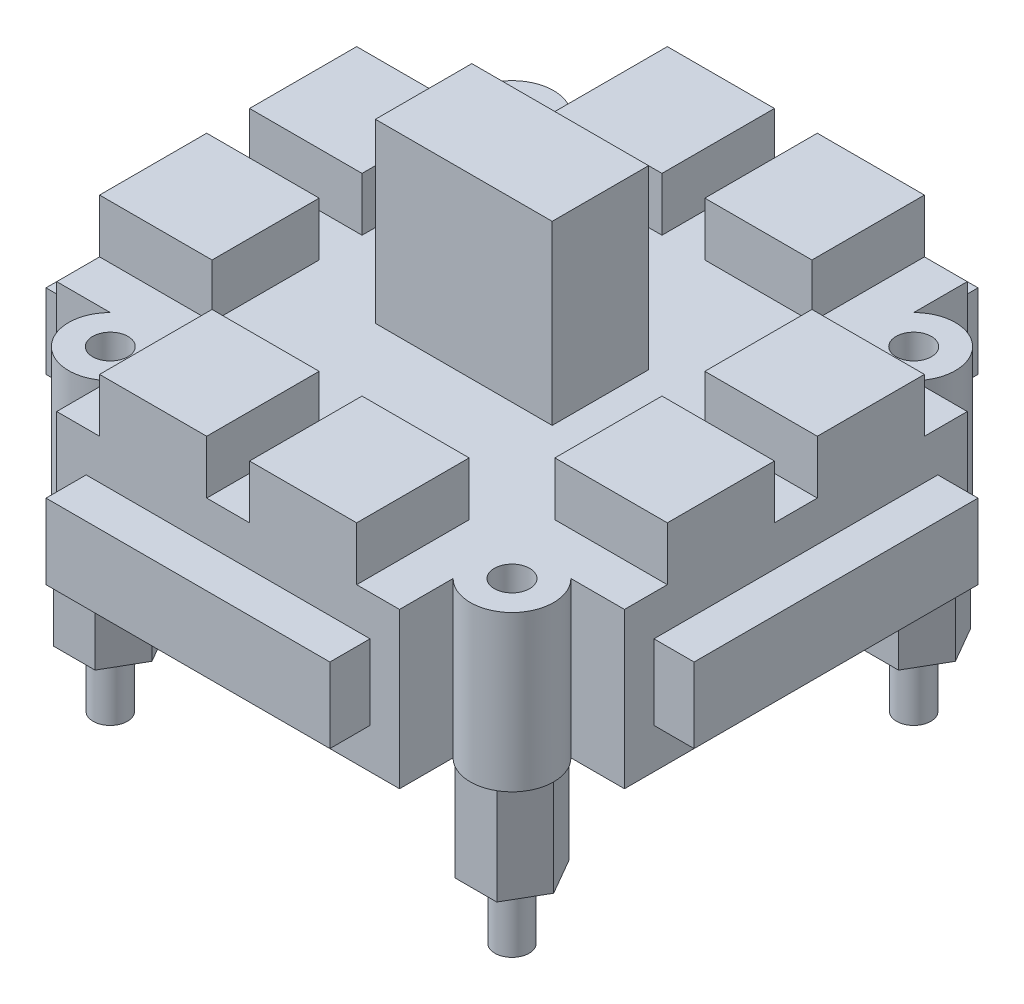
from build123d import *

# Parameters (mm, degrees)
SKETCH_1_R        = 3.889087297
SKETCH_1_R_2      = 1.65
EXTRUDE_2_DEPTH   = 7.25
EXTRUDE_2_2_DEPTH = 7.25
EXTRUDE_2_3_DEPTH = 7.25
EXTRUDE_2_4_DEPTH = 7.25
SKETCH_2_W        = 32
SKETCH_2_H        = 53
SKETCH_2_W_2      = 53
SKETCH_2_H_2      = 32
EXTRUDE_3_DEPTH   = 7.25
SKETCH_3_W        = 26.5
SKETCH_3_H        = 60.5
SKETCH_3_W_2      = 60.5
SKETCH_3_H_2      = 26.5
EXTRUDE_4_DEPTH   = 3.5
SKETCH_4_W        = 16.5
SKETCH_4_H        = 9
EXTRUDE_5_DEPTH   = 16.5
SKETCH_5_W        = 10.5
SKETCH_5_H        = 10
SKETCH_5_W_2      = 10
SKETCH_5_H_2      = 10.5
EXTRUDE_6_DEPTH   = 5
EXTRUDE_7_DEPTH   = 9
SKETCH_7_R        = 1.6
EXTRUDE_8_DEPTH   = 6


with BuildPart() as part:
    # 草图1 → 凸台-拉伸2 (new, symmetric)
    with BuildSketch(Plane(origin=(0, 0, 0), x_dir=(1, 0, 0), z_dir=(0, 1, 0))):
        with Locations(Location((-18.75, 18.75, 0), (0, 0, 90))):
            Circle(SKETCH_1_R)
        with Locations(Location((-18.75, 18.75, 0), (0, 0, 90))):
            Circle(SKETCH_1_R_2, mode=Mode.SUBTRACT)
    extrude(amount=EXTRUDE_2_DEPTH, both=True)



with BuildPart() as body_2:
    # 草图1 → Extrude 2 2 (new, symmetric)
    with BuildSketch(Plane(origin=(0, 0, 0), x_dir=(1, 0, 0), z_dir=(0, 1, 0))):
        with Locations(Location((18.75, 18.75, 0), (0, 0, 90))):
            Circle(SKETCH_1_R)
        with Locations(Location((18.75, 18.75, 0), (0, 0, 90))):
            Circle(SKETCH_1_R_2, mode=Mode.SUBTRACT)
    extrude(amount=EXTRUDE_2_2_DEPTH, both=True)


with BuildPart() as body_3:
    # 草图1 → Extrude 2 3 (new, symmetric)
    with BuildSketch(Plane(origin=(0, 0, 0), x_dir=(1, 0, 0), z_dir=(0, 1, 0))):
        with Locations(Location((18.75, -18.75, 0), (0, 0, 90))):
            Circle(SKETCH_1_R)
        with Locations(Location((18.75, -18.75, 0), (0, 0, 90))):
            Circle(SKETCH_1_R_2, mode=Mode.SUBTRACT)
    extrude(amount=EXTRUDE_2_3_DEPTH, both=True)


with BuildPart() as body_4:
    # 草图1 → Extrude 2 4 (new, symmetric)
    with BuildSketch(Plane(origin=(0, 0, 0), x_dir=(1, 0, 0), z_dir=(0, 1, 0))):
        with Locations(Location((-18.75, -18.75, 0), (0, 0, 90))):
            Circle(SKETCH_1_R)
        with Locations(Location((-18.75, -18.75, 0), (0, 0, 90))):
            Circle(SKETCH_1_R_2, mode=Mode.SUBTRACT)
    extrude(amount=EXTRUDE_2_4_DEPTH, both=True)


with BuildPart() as part_1:
    add(part.part)

    add(body_2.part)  # 凸台-拉伸3 merges body 2

    add(body_3.part)  # 凸台-拉伸3 merges body 3

    add(body_4.part)  # 凸台-拉伸3 merges body 4
    # 草图2 → 凸台-拉伸3 (add, symmetric)
    with BuildSketch(Plane(origin=(0, 0, 0), x_dir=(1, 0, 0), z_dir=(0, 1, 0))):
        Rectangle(SKETCH_2_W, SKETCH_2_H)
        Rectangle(SKETCH_2_W_2, SKETCH_2_H_2)
    extrude(amount=EXTRUDE_3_DEPTH, both=True)

    # 草图3 → 凸台-拉伸4 (add, symmetric)
    with BuildSketch(Plane(origin=(0, 0, 0), x_dir=(1, 0, 0), z_dir=(0, 1, 0))):
        Rectangle(SKETCH_3_W, SKETCH_3_H)
        Rectangle(SKETCH_3_W_2, SKETCH_3_H_2)
    extrude(amount=EXTRUDE_4_DEPTH, both=True)

    # 草图4 → 凸台-拉伸5 (add)
    with BuildSketch(Plane(origin=(0, 7.25, 0), x_dir=(1, 0, 0), z_dir=(0, 1, 0))):
        Rectangle(SKETCH_4_W, SKETCH_4_H)
    extrude(amount=EXTRUDE_5_DEPTH)

    # 草图5 → 凸台-拉伸6 (add)
    with BuildSketch(Plane(origin=(0, 7.25, 0), x_dir=(1, 0, 0), z_dir=(0, 1, 0))):
        with Locations((-21.25, 7)):
            Rectangle(SKETCH_5_W, SKETCH_5_H)
        with Locations((-21.25, -7)):
            Rectangle(SKETCH_5_W, SKETCH_5_H)
        with Locations((7, 21.25)):
            Rectangle(SKETCH_5_W_2, SKETCH_5_H_2)
        with Locations((-7, 21.25)):
            Rectangle(SKETCH_5_W_2, SKETCH_5_H_2)
        with Locations((21.25, -7)):
            Rectangle(SKETCH_5_W, SKETCH_5_H)
        with Locations((21.25, 7)):
            Rectangle(SKETCH_5_W, SKETCH_5_H)
        with Locations((-7, -21.25)):
            Rectangle(SKETCH_5_W_2, SKETCH_5_H_2)
        with Locations((7, -21.25)):
            Rectangle(SKETCH_5_W_2, SKETCH_5_H_2)
    extrude(amount=EXTRUDE_6_DEPTH)

    # 草图6 → 凸台-拉伸7 (add)
    with BuildSketch(Plane.XZ.offset(7.25)):
        Polygon((-14.860912703, 18.75), (-16.805456352, 22.118048396), (-20.694543648, 22.118048396), (-22.639087297, 18.75), (-20.694543648, 15.381951604), (-16.805456352, 15.381951604), align=None)
        Polygon((22.639087297, 18.75), (20.694543648, 22.118048396), (16.805456352, 22.118048396), (14.860912703, 18.75), (16.805456352, 15.381951604), (20.694543648, 15.381951604), align=None)
        Polygon((22.639087297, -18.75), (20.694543648, -15.381951604), (16.805456352, -15.381951604), (14.860912703, -18.75), (16.805456352, -22.118048396), (20.694543648, -22.118048396), align=None)
        Polygon((-14.860912703, -18.75), (-16.805456352, -15.381951604), (-20.694543648, -15.381951604), (-22.639087297, -18.75), (-20.694543648, -22.118048396), (-16.805456352, -22.118048396), align=None)
    extrude(amount=EXTRUDE_7_DEPTH)

    # 草图7 → 凸台-拉伸8 (add)
    with BuildSketch(Plane.XZ.offset(16.25)):
        with Locations(Location((-18.75, 18.75, 0), (0, 0, 270))):
            Circle(SKETCH_7_R)
        with Locations(Location((18.75, 18.75, 0), (0, 0, 270))):
            Circle(SKETCH_7_R)
        with Locations(Location((18.75, -18.75, 0), (0, 0, 270))):
            Circle(SKETCH_7_R)
        with Locations(Location((-18.75, -18.75, 0), (0, 0, 270))):
            Circle(SKETCH_7_R)
    extrude(amount=EXTRUDE_8_DEPTH)


solid = part_1.part
